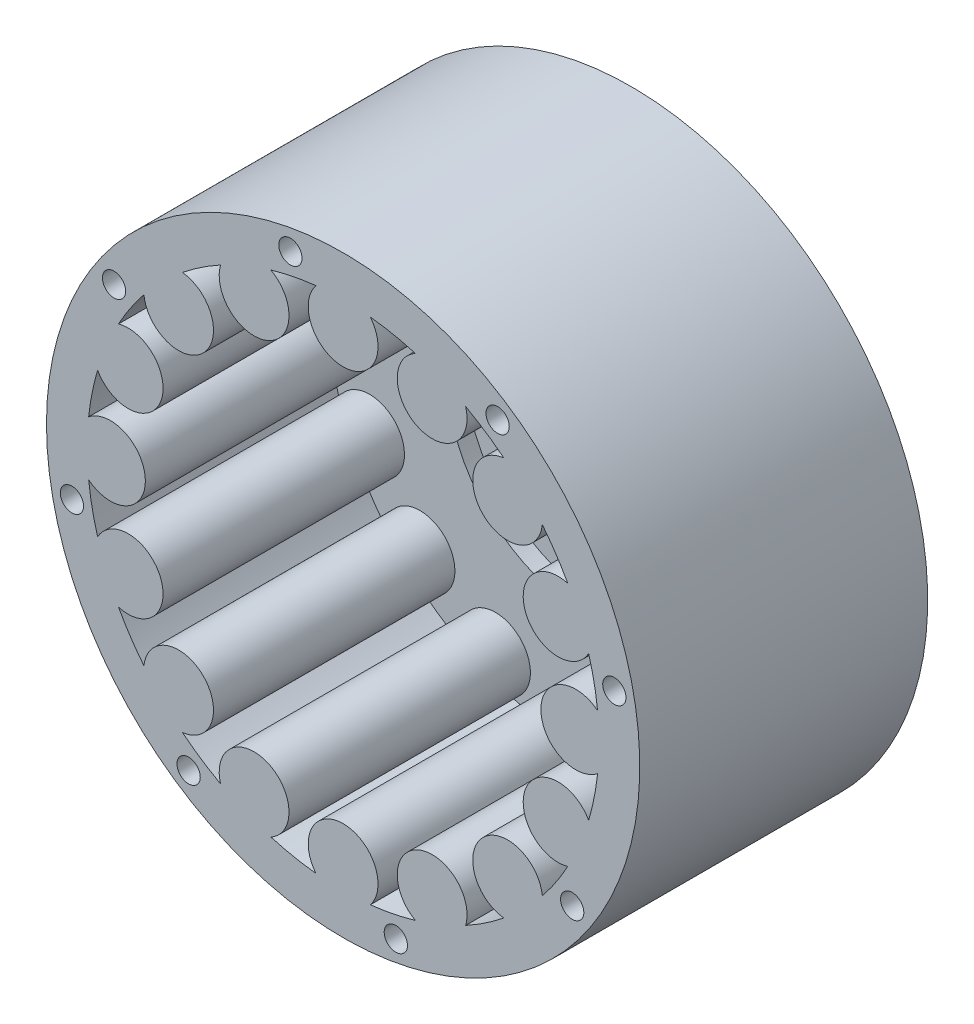
from build123d import *

# Parameters (mm, degrees)
SKETCH1_R           = 44
VOLUMEEXTRUDE_DEPTH = 8
SKETCH2_R           = 51
SKETCH2_R_2         = 44
LIPEXTRUDE_DEPTH    = 49.5
SKETCH4_R           = 18
SHAFT_HOLE_DEPTH    = 8
SKETCH6_R           = 2
BOLTHOLES_DEPTH     = 6
SKETCH7_R           = 6
BOSS_EXTRUDE1_DEPTH = 41.5
SKETCH9_R           = 2.25
CUT_EXTRUDE2_DEPTH  = 6
SKETCH11_R          = 23.6
CUT_EXTRUDE3_DEPTH  = 3


with BuildPart() as part:
    # Sketch1 → VolumeExtrude (new body)
    with BuildSketch(Plane.XY):
        Circle(SKETCH1_R)
    extrude(amount=VOLUMEEXTRUDE_DEPTH)

    # Sketch2 → LipExtrude (add)
    with BuildSketch(Plane(origin=(0, 0, 0), x_dir=(-1, 0, 0), z_dir=(0, 0, -1))):
        Circle(SKETCH2_R)
        Circle(SKETCH2_R_2, mode=Mode.SUBTRACT)
    extrude(amount=-LIPEXTRUDE_DEPTH)

    # Sketch4 → Shaft Hole (cut)
    with BuildSketch(Plane.XY.offset(8)):
        Circle(SKETCH4_R)
    extrude(amount=-SHAFT_HOLE_DEPTH, mode=Mode.SUBTRACT)

    # Sketch6 → BoltHoles (cut)
    with BuildSketch(Plane.XY.offset(49.5)):
        with Locations((-9.06342728, 46.627291214)):
            Circle(SKETCH6_R)
        with Locations((26.561662915, 39.379284696)):
            Circle(SKETCH6_R)
        with Locations((46.627291214, 9.06342728)):
            Circle(SKETCH6_R)
        with Locations((39.379284696, -26.561662915)):
            Circle(SKETCH6_R)
        with Locations((9.06342728, -46.627291214)):
            Circle(SKETCH6_R)
        with Locations((-26.561662915, -39.379284696)):
            Circle(SKETCH6_R)
        with Locations((-46.627291214, -9.06342728)):
            Circle(SKETCH6_R)
        with Locations((-39.379284696, 26.561662915)):
            Circle(SKETCH6_R)
    extrude(amount=-BOLTHOLES_DEPTH, mode=Mode.SUBTRACT)

    # Sketch7 → Boss-Extrude1 (add)
    with BuildSketch(Plane.XY.offset(8)):
        with Locations((0, 40)):
            Circle(SKETCH7_R)
        with Locations((15.307337295, 36.9551813)):
            Circle(SKETCH7_R)
        with Locations((28.284271247, 28.284271247)):
            Circle(SKETCH7_R)
        with Locations((36.9551813, 15.307337295)):
            Circle(SKETCH7_R)
        with Locations((40, 0)):
            Circle(SKETCH7_R)
        with Locations((36.9551813, -15.307337295)):
            Circle(SKETCH7_R)
        with Locations((28.284271247, -28.284271247)):
            Circle(SKETCH7_R)
        with Locations((15.307337295, -36.9551813)):
            Circle(SKETCH7_R)
        with Locations((0, -40)):
            Circle(SKETCH7_R)
        with Locations((-15.307337295, -36.9551813)):
            Circle(SKETCH7_R)
        with Locations((-28.284271247, -28.284271247)):
            Circle(SKETCH7_R)
        with Locations((-36.9551813, -15.307337295)):
            Circle(SKETCH7_R)
        with Locations((-40, 0)):
            Circle(SKETCH7_R)
        with Locations((-36.9551813, 15.307337295)):
            Circle(SKETCH7_R)
        with Locations((-28.284271247, 28.284271247)):
            Circle(SKETCH7_R)
        with Locations((-15.307337295, 36.9551813)):
            Circle(SKETCH7_R)
    extrude(amount=BOSS_EXTRUDE1_DEPTH)

    # Sketch9 → Cut-Extrude2 (cut)
    with BuildSketch(Plane(origin=(0, 0, 0), x_dir=(-1, 0, 0), z_dir=(0, 0, -1))):
        with Locations((-26.561662915, 39.379284696)):
            Circle(SKETCH9_R)
        with Locations((39.379284696, 26.561662915)):
            Circle(SKETCH9_R)
        with Locations((26.561662915, -39.379284696)):
            Circle(SKETCH9_R)
        with Locations((-39.379284696, -26.561662915)):
            Circle(SKETCH9_R)
    extrude(amount=-CUT_EXTRUDE2_DEPTH, mode=Mode.SUBTRACT)

    # Sketch11 → Cut-Extrude3 (cut)
    with BuildSketch(Plane.XY.offset(8)):
        Circle(SKETCH11_R)
    extrude(amount=-CUT_EXTRUDE3_DEPTH, mode=Mode.SUBTRACT)


solid = part.part
